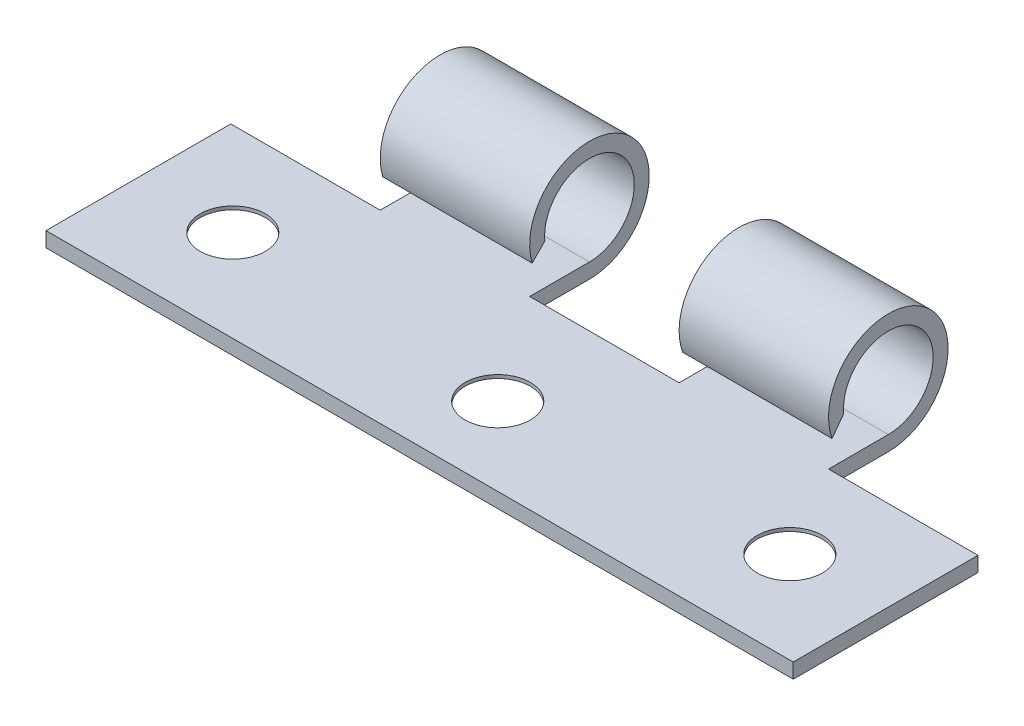
from build123d import *
from OCP.BRepFilletAPI import BRepFilletAPI_MakeChamfer

# Parameters (mm, degrees)
BOSS_EXTRUDE1_DEPTH = 11
SKETCH2_W           = 13.6
SKETCH2_H           = 1.1
BOSS_EXTRUDE2_DEPTH = 11
BOSS_EXTRUDE3_DEPTH = 11
SKETCH4_W           = 13.6
SKETCH4_H           = 1.1
BOSS_EXTRUDE4_DEPTH = 11
SKETCH5_W           = 13.6
SKETCH5_H           = 1.1
BOSS_EXTRUDE5_DEPTH = 11
HOLE_WIZARD_M4_1_D  = 4.8
CHAMFER1_SIZE       = 0.85
CHAMFER1_SIZE2      = 1.472243186


with BuildPart() as part:
    # Sketch1 → Boss-Extrude1 (new body)
    with BuildSketch(Plane(origin=(62.103, 0, 0), x_dir=(0, 0, -1), z_dir=(1, 0, 0))):
        with BuildLine():
            Line((34.275005652, 2.916847756), (35.133702257, 4.073392616))
            ThreePointArc((35.133702257, 4.073392616), (40.63247129, 6.846201583), (38.4175, 1.1))
            Line((38.4175, 1.1), (20.4175, 1.1))
            Line((20.4175, 1.1), (20.4175, 0))
            Line((20.4175, 0), (38.4175, 0))
            ThreePointArc((38.4175, 0), (40.950692662, 7.997629072), (34.275005652, 2.916847756))
        make_face()
    extrude(amount=-BOSS_EXTRUDE1_DEPTH)

    # Sketch2 → Boss-Extrude2 (add)
    with BuildSketch(Plane.ZY.offset(-51.103)):
        with Locations((-27.2175, 0.55)):
            Rectangle(SKETCH2_W, SKETCH2_H)
    extrude(amount=BOSS_EXTRUDE2_DEPTH)

    # Sketch3 → Boss-Extrude3 (add)
    with BuildSketch(Plane.ZY.offset(-40.103)):
        with BuildLine():
            Line((-38.4175, 1.1), (-20.4175, 1.1))
            Line((-20.4175, 1.1), (-20.4175, 0))
            Line((-20.4175, 0), (-38.4175, 0))
            ThreePointArc((-38.4175, 0), (-41.043236571, 7.930652555), (-34.203607486, 3.133860244))
            Line((-34.203607486, 3.133860244), (-35.133702257, 4.073392616))
            ThreePointArc((-35.133702257, 4.073392616), (-40.63247129, 6.846201583), (-38.4175, 1.1))
        make_face()
    extrude(amount=BOSS_EXTRUDE3_DEPTH)

    # Sketch4 → Boss-Extrude4 (add)
    with BuildSketch(Plane.ZY.offset(-29.103)):
        with Locations((-27.2175, 0.55)):
            Rectangle(SKETCH4_W, SKETCH4_H)
    extrude(amount=BOSS_EXTRUDE4_DEPTH)

    # Sketch5 → Boss-Extrude5 (add)
    with BuildSketch(Plane(origin=(62.103, 0, 0), x_dir=(0, 0, -1), z_dir=(1, 0, 0))):
        with Locations((27.2175, 0.55)):
            Rectangle(SKETCH5_W, SKETCH5_H)
    extrude(amount=BOSS_EXTRUDE5_DEPTH)

    # M4 间隙孔1 (through all)
    with Locations(Plane(origin=(0, 1.1, 0), x_dir=(1, 0, 0), z_dir=(0, 1, 0))):
        with Locations((45.603, 26.1675), (25.103, 27.1675), (66.103, 27.1675)):
            Hole(HOLE_WIZARD_M4_1_D / 2)

    # Chamfer1: one chamfer whose edges measure the first distance from different faces: ONE call of the kernel's chamfer builder (chamfer() names one face for all edges)
    chamfer1_edges_1 = [part.edges().sort_by_distance(p)[0] for p in [
        (68.503, 0, -27.1675),
    ]]
    chamfer1_side_1 = [part.faces().sort_by_distance(p)[0] for p in [
        (68.503, 0.55, -27.1675),
    ]]
    chamfer1_edges_2 = [part.edges().sort_by_distance(p)[0] for p in [
        (27.503, 0, -27.1675),
    ]]
    chamfer1_side_2 = [part.faces().sort_by_distance(p)[0] for p in [
        (27.503, 0.55, -27.1675),
    ]]
    chamfer1_edges_3 = [part.edges().sort_by_distance(p)[0] for p in [
        (48.003, 0, -26.1675),
    ]]
    chamfer1_side_3 = [part.faces().sort_by_distance(p)[0] for p in [
        (48.003, 0.55, -26.1675),
    ]]
    chamfer1 = BRepFilletAPI_MakeChamfer(part.part.solid().wrapped)
    for e in chamfer1_edges_1:
        chamfer1.Add(CHAMFER1_SIZE, CHAMFER1_SIZE2, e.wrapped, chamfer1_side_1[0].wrapped)  # the first distance lies on this face
    for e in chamfer1_edges_2:
        chamfer1.Add(CHAMFER1_SIZE, CHAMFER1_SIZE2, e.wrapped, chamfer1_side_2[0].wrapped)  # the first distance lies on this face
    for e in chamfer1_edges_3:
        chamfer1.Add(CHAMFER1_SIZE, CHAMFER1_SIZE2, e.wrapped, chamfer1_side_3[0].wrapped)  # the first distance lies on this face
    add(Compound.cast(chamfer1.Shape()), mode=Mode.REPLACE)


solid = part.part
